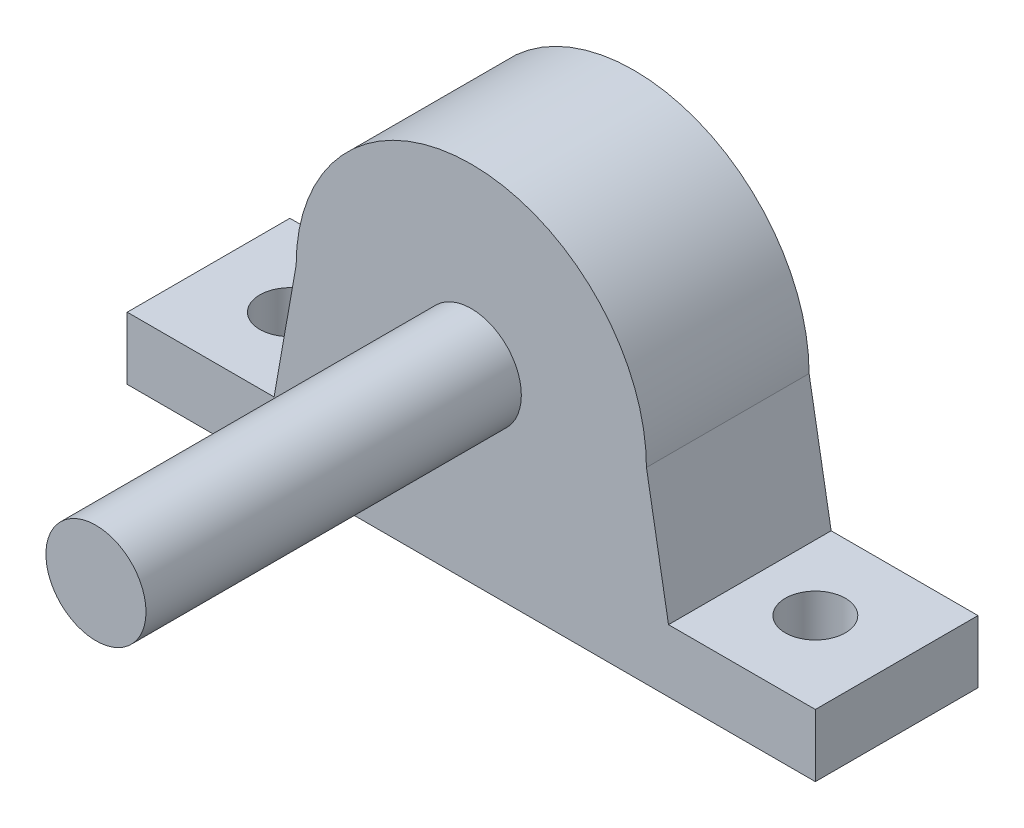
from build123d import *

# Parameters (mm, degrees)
EXTRUDE_1_DEPTH      = 13
SKETCH_2_R           = 4
CUT_EXTRUDE_1_DEPTH  = 13
CUT_EXTRUDE_2_REACH  = 63.4
SKETCH_3_R           = 2.4
EXTRUDE_2_DEPTH      = 30
EXTRUDE_2_DEPTH_BACK = 13
SKETCH_4_R           = 4


with BuildPart() as part:
    # 草图1 → 凸台-拉伸1 (new body)
    with BuildSketch(Plane.XY):
        with BuildLine():
            Line((0, 0), (55, 0))
            Line((55, 0), (55, 5))
            Line((55, 5), (43.263269807, 5))
            Line((43.263269807, 5), (41.5, 15))
            ThreePointArc((41.5, 15), (27.5, 29), (13.5, 15))
            Line((13.5, 15), (11.736730193, 5))
            Line((11.736730193, 5), (0, 5))
            Line((0, 5), (0, 0))
        make_face()
    extrude(amount=EXTRUDE_1_DEPTH)

    # 草图2 → 切除-拉伸1 (cut)
    with BuildSketch(Plane.XY.offset(13)):
        with Locations((27.5, 15)):
            Circle(SKETCH_2_R)
    extrude(amount=-CUT_EXTRUDE_1_DEPTH, mode=Mode.SUBTRACT)

    # 草图3 → 切除-拉伸2 (cut, up to next)
    with BuildSketch(Plane(origin=(0, 5, 0), x_dir=(1, 0, 0), z_dir=(0, 1, 0)), mode=Mode.PRIVATE) as cut_extrude_2_sk1:
        with Locations(Location((6.5, -6.5, 0), (0, 0, 180))):
            Circle(SKETCH_3_R)
    cut_extrude_2_tool1 = extrude(cut_extrude_2_sk1.sketch, amount=-CUT_EXTRUDE_2_REACH, mode=Mode.PRIVATE) & part.part
    # 草图3 → 切除-拉伸2 (cut, up to next)
    with BuildSketch(Plane(origin=(0, 5, 0), x_dir=(1, 0, 0), z_dir=(0, 1, 0)), mode=Mode.PRIVATE) as cut_extrude_2_sk2:
        with Locations(Location((48.5, -6.5, 0), (0, 0, 180))):
            Circle(SKETCH_3_R)
    cut_extrude_2_tool2 = extrude(cut_extrude_2_sk2.sketch, amount=-CUT_EXTRUDE_2_REACH, mode=Mode.PRIVATE) & part.part
    add(cut_extrude_2_tool1.solids().sort_by_distance((6.5, 5, 6.5))[0], mode=Mode.SUBTRACT)
    add(cut_extrude_2_tool2.solids().sort_by_distance((48.5, 5, 6.5))[0], mode=Mode.SUBTRACT)

    # 草图4 → 凸台-拉伸2 (add, two sides: drawn at the far end of the back side and taken through both)
    with BuildSketch(Plane.XY.offset(13).offset(-EXTRUDE_2_DEPTH_BACK)):
        with Locations((27.5, 15)):
            Circle(SKETCH_4_R)
    extrude(amount=EXTRUDE_2_DEPTH + EXTRUDE_2_DEPTH_BACK)


solid = part.part
